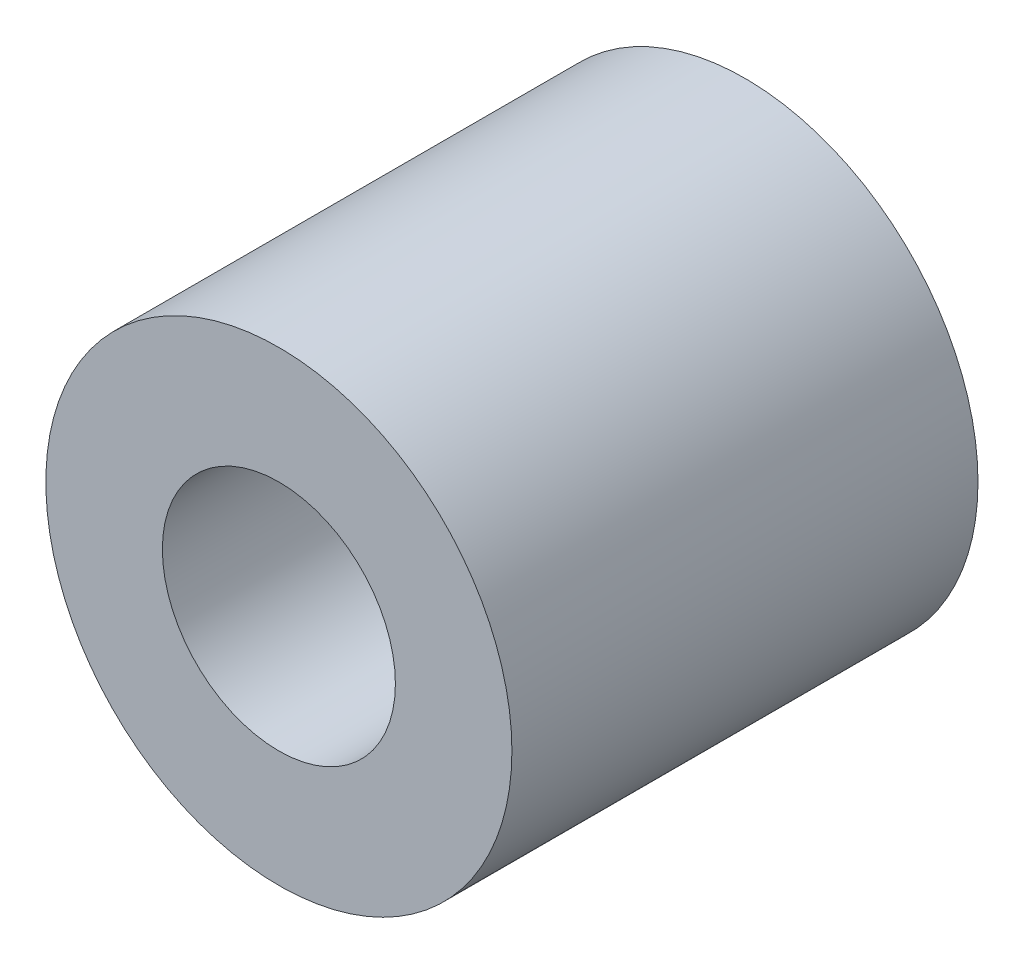
from build123d import *

# Parameters (mm, degrees)
SKETCH_1_R      = 2
SKETCH_1_R_2    = 1
EXTRUDE_1_DEPTH = 4


with BuildPart() as part:
    # 草图1 → 凸台-拉伸1 (new body)
    with BuildSketch(Plane.XY):
        Circle(SKETCH_1_R)
        Circle(SKETCH_1_R_2, mode=Mode.SUBTRACT)
    extrude(amount=EXTRUDE_1_DEPTH)


solid = part.part
